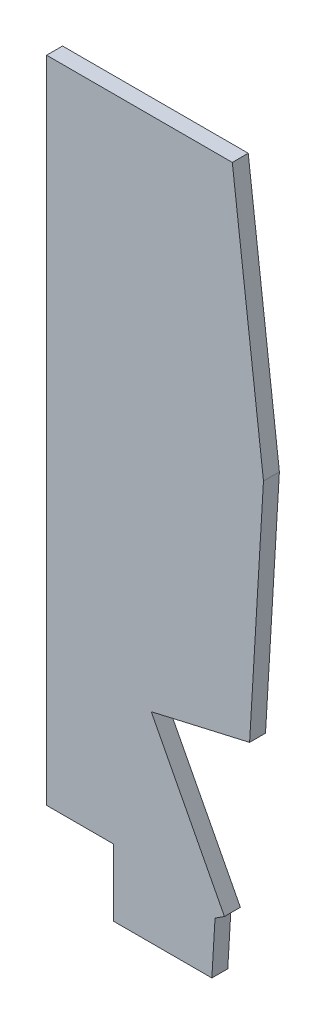
from build123d import *

# Parameters (mm, degrees)
SKETCH1_W           = 200
SKETCH1_H           = 225
BOSS_EXTRUDE1_DEPTH = 5
SKETCH2_W           = 21
SKETCH2_H           = 21
CUT_EXTRUDE1_DEPTH  = 151.602954818
CUT_EXTRUDE2_DEPTH  = 151.602954818


with BuildPart() as part:
    # Sketch1 → Boss-Extrude1 (new body)
    with BuildSketch(Plane.XY):
        Rectangle(SKETCH1_W, SKETCH1_H)
    extrude(amount=BOSS_EXTRUDE1_DEPTH)

    # Sketch2 → Cut-Extrude1 (cut, through all)
    with BuildSketch(Plane.XY.offset(5)):
        with Locations((-89.5, -102)):
            Rectangle(SKETCH2_W, SKETCH2_H)
    extrude(amount=-CUT_EXTRUDE1_DEPTH, mode=Mode.SUBTRACT)

    # Sketch3 → Cut-Extrude2 (cut, through all)
    with BuildSketch(Plane.XY.offset(5)):
        Polygon((-47.115076642, -95.712122393), (-48.11426359, -112.5), (100, -112.5), (100, 112.5), (-41.68901441, 112.5), (-31.902672347, 30.754430855), (-36.262952178, -42.504976974), (-67.144755679, -49.596294754), (-44.155064893, -93.798693152), align=None)
    extrude(amount=-CUT_EXTRUDE2_DEPTH, mode=Mode.SUBTRACT)


solid = part.part
